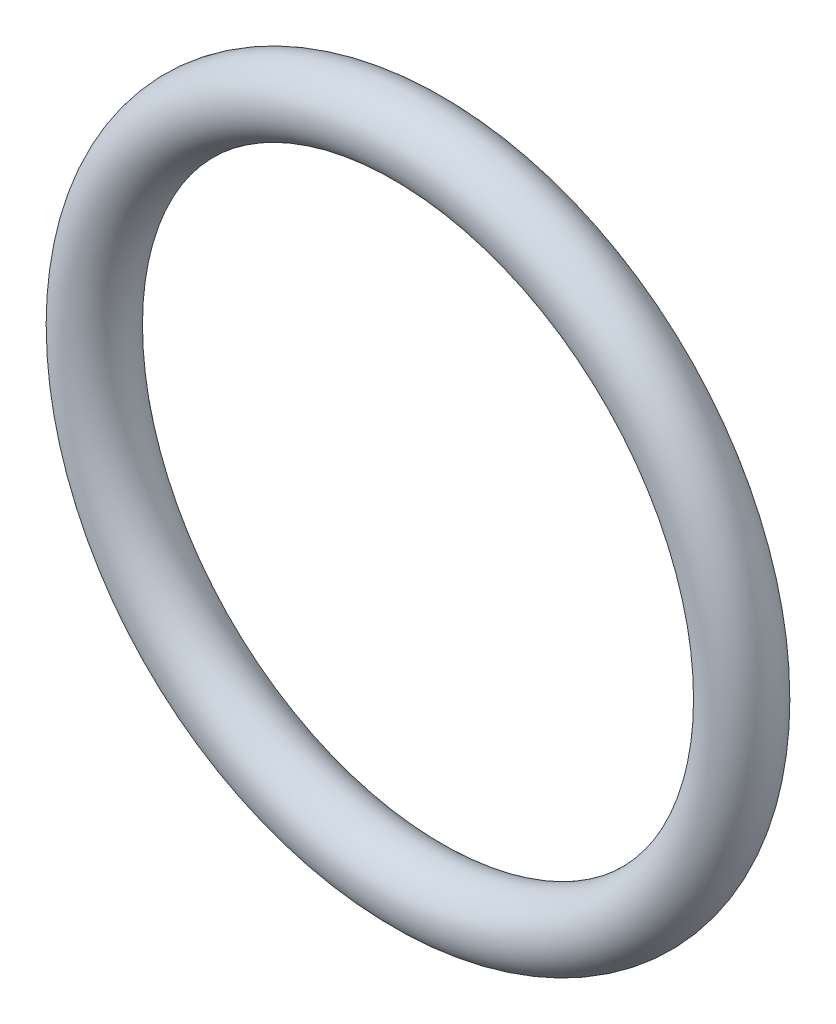
from build123d import *

# Parameters (mm, degrees)
SKETCH1_R = 1


with BuildPart() as part:
    # Sketch1 → Revolve1 (revolve)
    with BuildSketch(Plane(origin=(0, 0, 0), x_dir=(0, -1, 0), z_dir=(1, 0, 0)), mode=Mode.PRIVATE) as revolve1_sk:
        with Locations((9.5, 0)):
            Circle(SKETCH1_R)
    revolve(revolve1_sk.sketch.rotate(Axis((0, 0, 1), (0, 0, -1)), 270), axis=Axis((0, 0, 1), (0, 0, -1)))


solid = part.part
